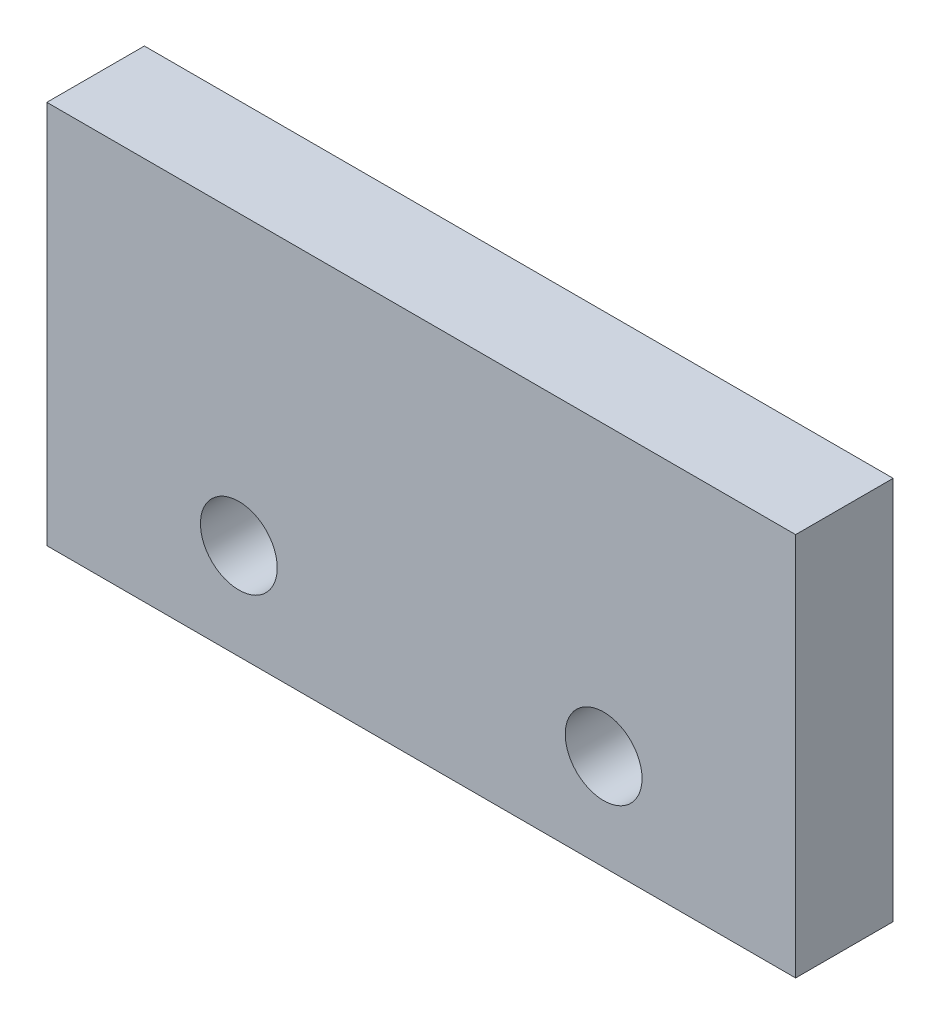
from build123d import *

# Parameters (mm, degrees)
SKETCH2_W           = 19.5
SKETCH2_H           = 10
SKETCH2_R           = 1
BOSS_EXTRUDE1_DEPTH = 1.27


with BuildPart() as part:
    # Sketch2 → Boss-Extrude1 (new, symmetric)
    with BuildSketch(Plane.XY):
        Rectangle(SKETCH2_W, SKETCH2_H)
        with Locations((-4.75, -2.5)):
            Circle(SKETCH2_R, mode=Mode.SUBTRACT)
        with Locations((4.75, -2.5)):
            Circle(SKETCH2_R, mode=Mode.SUBTRACT)
    extrude(amount=BOSS_EXTRUDE1_DEPTH, both=True)


solid = part.part
